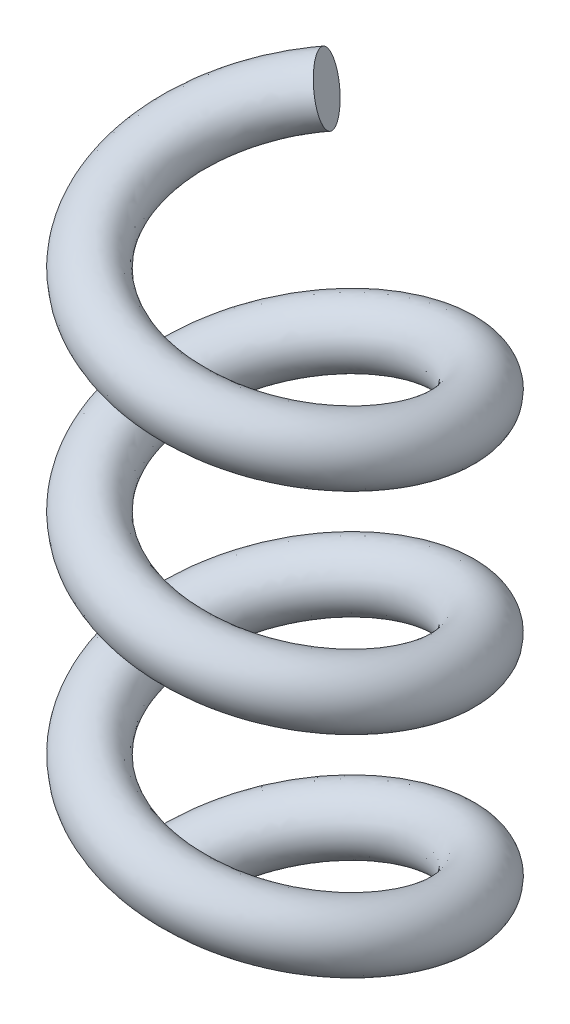
from build123d import *

# Parameters (mm, degrees)
SWEEP1_PITCH       = 38.824
SWEEP1_HEIGHT      = 122.644
SWEEP1_RADIUS      = 25.4
SWEEP1_START_ANGLE = -90
SKETCH2_R          = 5.577590445


with BuildPart() as part:
    # Sweep1: sweep along a helix
    with BuildLine() as sweep1_path:
        add(Helix(SWEEP1_PITCH, SWEEP1_HEIGHT, SWEEP1_RADIUS, center=(0, 0, 0), direction=(0, 1, 0), lefthand=True, mode=Mode.PRIVATE).rotate(Axis((0, 0, 0), (0, 1, 0)), SWEEP1_START_ANGLE))
    # Sketch2 → Sweep1 (sweep)
    with BuildSketch(Plane(origin=(-13.747991779, 122.644, -21.357732137), x_dir=(-0.5052030595763846, -0.14616091279359186, -0.8505332775182899), z_dir=(0.817027316474036, 0.2363751685377286, -0.525921233488434))):
        with Locations((0.104450233, -0.141272618)):
            Circle(SKETCH2_R)
    sweep(path=sweep1_path.line, is_frenet=True)


solid = part.part
